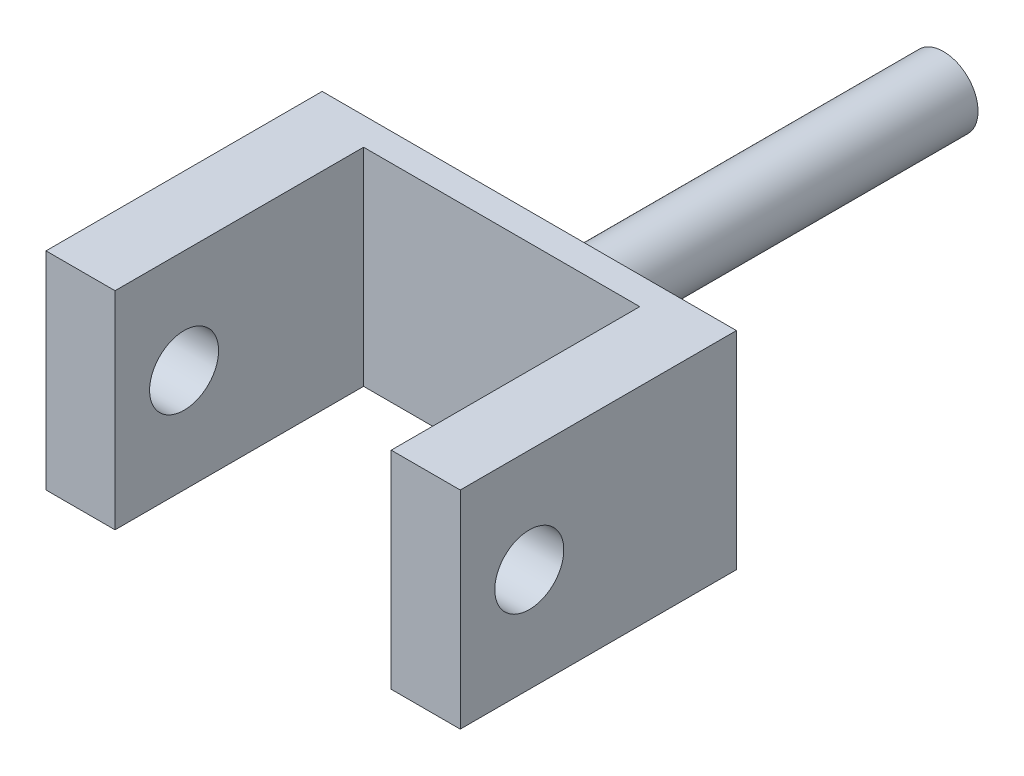
from build123d import *

# Parameters (mm, degrees)
EXTRUDE_1_DEPTH     = 150
SKETCH_2_R          = 25
EXTRUDE_2_DEPTH     = 300
SKETCH_3_R          = 25
CUT_EXTRUDE_1_DEPTH = 300


with BuildPart() as part:
    # 스케치1 → 보스-돌출1 (new body)
    with BuildSketch(Plane(origin=(0, 0, 0), x_dir=(1, 0, 0), z_dir=(0, 1, 0))):
        Polygon((-100, -100), (-150, -100), (-150, 100), (150, 100), (150, -100), (100, -100), (100, 80), (-100, 80), align=None)
    extrude(amount=EXTRUDE_1_DEPTH)

    # 스케치2 → 보스-돌출2 (add)
    with BuildSketch(Plane(origin=(0, 0, -100), x_dir=(-1, 0, 0), z_dir=(0, 0, -1))):
        with Locations((0, 75)):
            Circle(SKETCH_2_R)
    extrude(amount=EXTRUDE_2_DEPTH)

    # 스케치3 → 컷-돌출1 (cut)
    with BuildSketch(Plane.ZY.offset(150)):
        with Locations((50, 75)):
            Circle(SKETCH_3_R)
    extrude(amount=-CUT_EXTRUDE_1_DEPTH, mode=Mode.SUBTRACT)


solid = part.part
